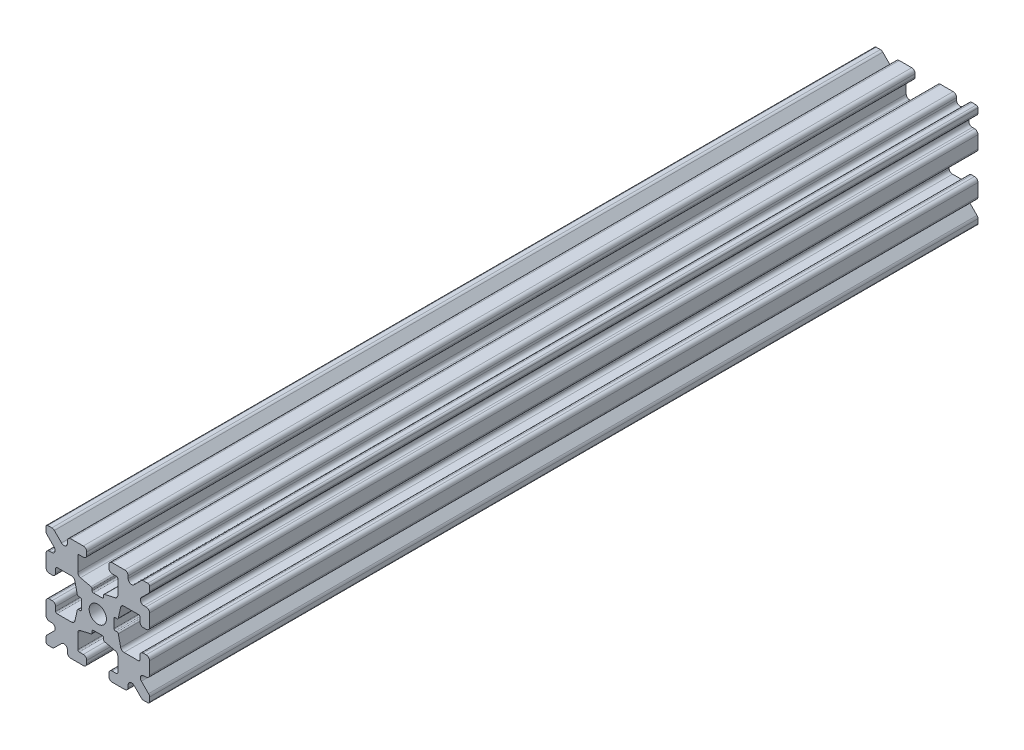
from build123d import *

# Parameters (mm, degrees)
SKETCH1_W           = 15
SKETCH1_H           = 15
SKETCH1_R           = 1.25
BOSS_EXTRUDE1_DEPTH = 60
FILLET1_R           = 0.25
CUT_EXTRUDE1_DEPTH  = 121.467838032
CUT_EXTRUDE3_DEPTH  = 121.467838032
FILLET3_R           = 0.5
FILLET4_R           = 0.5
FILLET5_R           = 3
FILLET6_R           = 0.2
CUT_EXTRUDE4_DEPTH  = 121.467838032
FILLET8_R           = 0.5
SKETCH6_W           = 5.1529354
SKETCH6_H           = 1.651
SKETCH6_W_2         = 1.651
SKETCH6_H_2         = 5.1529354
CUT_EXTRUDE5_DEPTH  = 121.467838032
FILLET10_R          = 0.2


with BuildPart() as part:
    # Sketch1 → Boss-Extrude1 (new, symmetric)
    with BuildSketch(Plane.XY):
        Rectangle(SKETCH1_W, SKETCH1_H)
        Circle(SKETCH1_R, mode=Mode.SUBTRACT)
    extrude(amount=BOSS_EXTRUDE1_DEPTH, both=True)

    # Fillet1
    fillet1_edges = [part.edges().sort_by_distance(p)[0] for p in [
        (7.5, -7.5, 0),
        (-7.5, -7.5, 0),
        (-7.5, 7.5, 0),
        (7.5, 7.5, 0),
    ]]
    fillet(fillet1_edges, radius=FILLET1_R)

    # Sketch2 → Cut-Extrude1 (cut, through all)
    with BuildSketch(Plane.XY.offset(60)):
        Polygon((-7.5, 1.6), (-6.1, 1.6), (-6.1, 2.9), (-3.4, 2.9), (-3.4, -2.9), (-6.1, -2.9), (-6.1, -1.6), (-7.5, -1.6), align=None)
        Polygon((2.9, 6.1), (1.6, 6.1), (1.6, 7.5), (-1.6, 7.5), (-1.6, 6.1), (-2.9, 6.1), (-2.9, 3.4), (2.9, 3.4), align=None)
        Polygon((-1.6, -7.5), (-1.6, -6.1), (-2.9, -6.1), (-2.9, -3.4), (2.9, -3.4), (2.9, -6.1), (1.6, -6.1), (1.6, -7.5), align=None)
        Polygon((6.1, -2.9), (6.1, -1.6), (7.5, -1.6), (7.5, 1.6), (6.1, 1.6), (6.1, 2.9), (3.4, 2.9), (3.4, -2.9), align=None)
    extrude(amount=-CUT_EXTRUDE1_DEPTH, mode=Mode.SUBTRACT)

    # Sketch4 → Cut-Extrude3 (cut, through all)
    with BuildSketch(Plane.XY.offset(60)):
        Polygon((-3.4, 2.9), (-2.75, 0), (-3.4, -2.9), align=None)
        Polygon((-2.9, 3.4), (0, 2.75), (2.9, 3.4), align=None)
        Polygon((3.4, 2.9), (2.75, 0), (3.4, -2.9), align=None)
        Polygon((-2.9, -3.4), (0, -2.75), (2.9, -3.4), align=None)
    extrude(amount=-CUT_EXTRUDE3_DEPTH, mode=Mode.SUBTRACT)

    # Fillet3
    fillet3_edges = [part.edges().sort_by_distance(p)[0] for p in [
        (1.6, -7.5, 0),
        (-1.6, -7.5, 0),
        (-1.6, -6.1, 0),
        (1.6, -6.1, 0),
        (6.1, 1.6, 0),
        (7.5, 1.6, 0),
        (7.5, -1.6, 0),
        (6.1, -1.6, 0),
        (-7.5, -1.6, 0),
        (-7.5, 1.6, 0),
        (-6.1, 1.6, 0),
        (-6.1, -1.6, 0),
        (-1.6, 6.1, 0),
        (-1.6, 7.5, 0),
        (1.6, 7.5, 0),
        (1.6, 6.1, 0),
    ]]
    fillet(fillet3_edges, radius=FILLET3_R)

    # Fillet4
    fillet4_edges = [part.edges().sort_by_distance(p)[0] for p in [
        (-2.9, -3.4, 0),
        (2.9, -3.4, 0),
        (3.4, -2.9, 0),
        (3.4, 2.9, 0),
        (-3.4, 2.9, 0),
        (-3.4, -2.9, 0),
        (2.9, 3.4, 0),
        (-2.9, 3.4, 0),
    ]]
    fillet(fillet4_edges, radius=FILLET4_R)

    # Fillet5
    fillet5_edges = [part.edges().sort_by_distance(p)[0] for p in [
        (-2.75, 0, 0),
        (0, 2.75, 0),
        (2.75, 0, 0),
        (0, -2.75, 0),
    ]]
    fillet(fillet5_edges, radius=FILLET5_R)

    # Fillet6
    fillet6_edges = [part.edges().sort_by_distance(p)[0] for p in [
        (-2.9, -6.1, 0),
        (2.9, -6.1, 0),
        (6.1, -2.9, 0),
        (6.1, 2.9, 0),
        (-6.1, 2.9, 0),
        (-6.1, -2.9, 0),
        (2.9, 6.1, 0),
        (-2.9, 6.1, 0),
    ]]
    fillet(fillet6_edges, radius=FILLET6_R)

    # Sketch5 → Cut-Extrude4 (cut, through all)
    with BuildSketch(Plane.XY.offset(60)):
        Polygon((-7.5, 6.439339828), (-5.460660172, 4.4), (-7.5, 4.4), align=None)
        Polygon((-6.439339828, 7.5), (-4.4, 5.460660172), (-4.4, 7.5), align=None)
        Polygon((4.4, 7.5), (6.439339828, 7.5), (4.4, 5.460660172), align=None)
        Polygon((7.5, 6.439339828), (7.5, 4.4), (5.460660172, 4.4), align=None)
        Polygon((7.5, -6.439339828), (5.460660172, -4.4), (7.5, -4.4), align=None)
        Polygon((6.439339828, -7.5), (4.4, -5.460660172), (4.4, -7.5), align=None)
        Polygon((-4.4, -7.5), (-6.439339828, -7.5), (-4.4, -5.460660172), align=None)
        Polygon((-7.5, -6.439339828), (-7.5, -4.4), (-5.460660172, -4.4), align=None)
    extrude(amount=-CUT_EXTRUDE4_DEPTH, mode=Mode.SUBTRACT)

    # Fillet8
    fillet8_edges = [part.edges().sort_by_distance(p)[0] for p in [
        (-7.5, 4.4, 0),
        (-7.5, 6.439339828, 0),
        (-5.460660172, 4.4, 0),
        (7.5, -4.4, 0),
        (7.5, -6.439339828, 0),
        (5.460660172, -4.4, 0),
        (5.460660172, 4.4, 0),
        (7.5, 6.439339828, 0),
        (7.5, 4.4, 0),
        (-4.4, 7.5, 0),
        (-4.4, 5.460660172, 0),
        (-6.439339828, 7.5, 0),
        (-5.460660172, -4.4, 0),
        (-7.5, -6.439339828, 0),
        (-7.5, -4.4, 0),
        (4.4, 5.460660172, 0),
        (4.4, 7.5, 0),
        (6.439339828, 7.5, 0),
        (6.439339828, -7.5, 0),
        (4.4, -7.5, 0),
        (4.4, -5.460660172, 0),
        (-6.439339828, -7.5, 0),
        (-4.4, -5.460660172, 0),
        (-4.4, -7.5, 0),
    ]]
    fillet(fillet8_edges, radius=FILLET8_R)

    # Sketch6 → Cut-Extrude5 (cut, through all)
    with BuildSketch(Plane.XY.offset(60)):
        with Locations((4.9235323, 0)):
            Rectangle(SKETCH6_W, SKETCH6_H)
        with Locations((0, -4.9235323)):
            Rectangle(SKETCH6_W_2, SKETCH6_H_2)
        with Locations((-4.9235323, 0)):
            Rectangle(SKETCH6_W, SKETCH6_H)
        with Locations((0, 4.9235323)):
            Rectangle(SKETCH6_W_2, SKETCH6_H_2)
    extrude(amount=-CUT_EXTRUDE5_DEPTH, mode=Mode.SUBTRACT)

    # Fillet10
    fillet10_edges = [part.edges().sort_by_distance(p)[0] for p in [
        (0.8255, -2.935025862, 0),
        (-0.8255, -2.935025862, 0),
        (0.8255, -2.3470646, 0),
        (-0.8255, -2.3470646, 0),
        (2.935025862, 0.8255, 0),
        (2.935025862, -0.8255, 0),
        (2.3470646, 0.8255, 0),
        (2.3470646, -0.8255, 0),
        (-2.935025862, -0.8255, 0),
        (-2.935025862, 0.8255, 0),
        (-2.3470646, -0.8255, 0),
        (-2.3470646, 0.8255, 0),
        (-0.8255, 2.935025862, 0),
        (0.8255, 2.935025862, 0),
        (-0.8255, 2.3470646, 0),
        (0.8255, 2.3470646, 0),
    ]]
    fillet(fillet10_edges, radius=FILLET10_R)


solid = part.part
